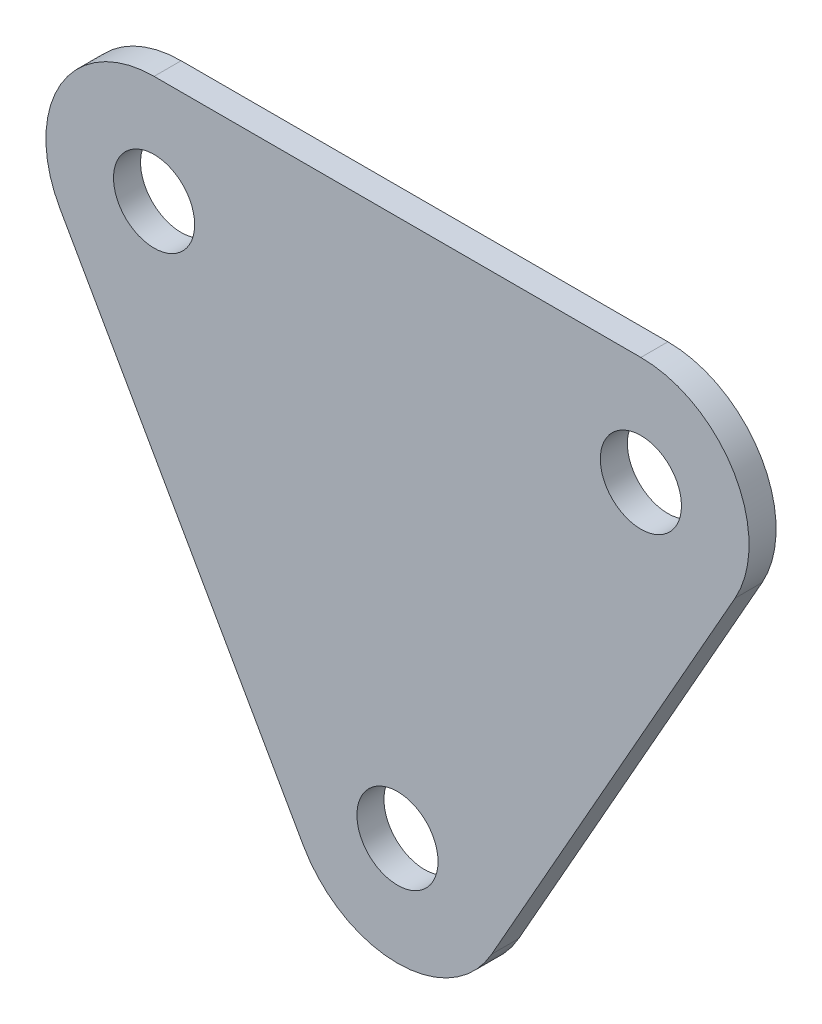
from build123d import *

# Parameters (mm, degrees)
SKETCH2_R           = 30
BOSS_EXTRUDE1_DEPTH = 20


with BuildPart() as part:
    # Sketch2 → Boss-Extrude1 (new body)
    with BuildSketch(Plane.XY):
        with BuildLine():
            Line((0, 80), (360, 80))
            ThreePointArc((360, 80), (429.110884118, 40.294983515), (429.620548406, -39.407857588))
            Line((429.620548406, -39.407857588), (249.620548406, -357.407857588))
            ThreePointArc((249.620548406, -357.407857588), (180, -398), (110.379451594, -357.407857588))
            Line((110.379451594, -357.407857588), (-69.620548406, -39.407857588))
            ThreePointArc((-69.620548406, -39.407857588), (-69.110884118, 40.294983515), (0, 80))
        make_face()
        Circle(SKETCH2_R, mode=Mode.SUBTRACT)
        with Locations((360, 0)):
            Circle(SKETCH2_R, mode=Mode.SUBTRACT)
        with Locations((180, -318)):
            Circle(SKETCH2_R, mode=Mode.SUBTRACT)
    extrude(amount=BOSS_EXTRUDE1_DEPTH)


solid = part.part
